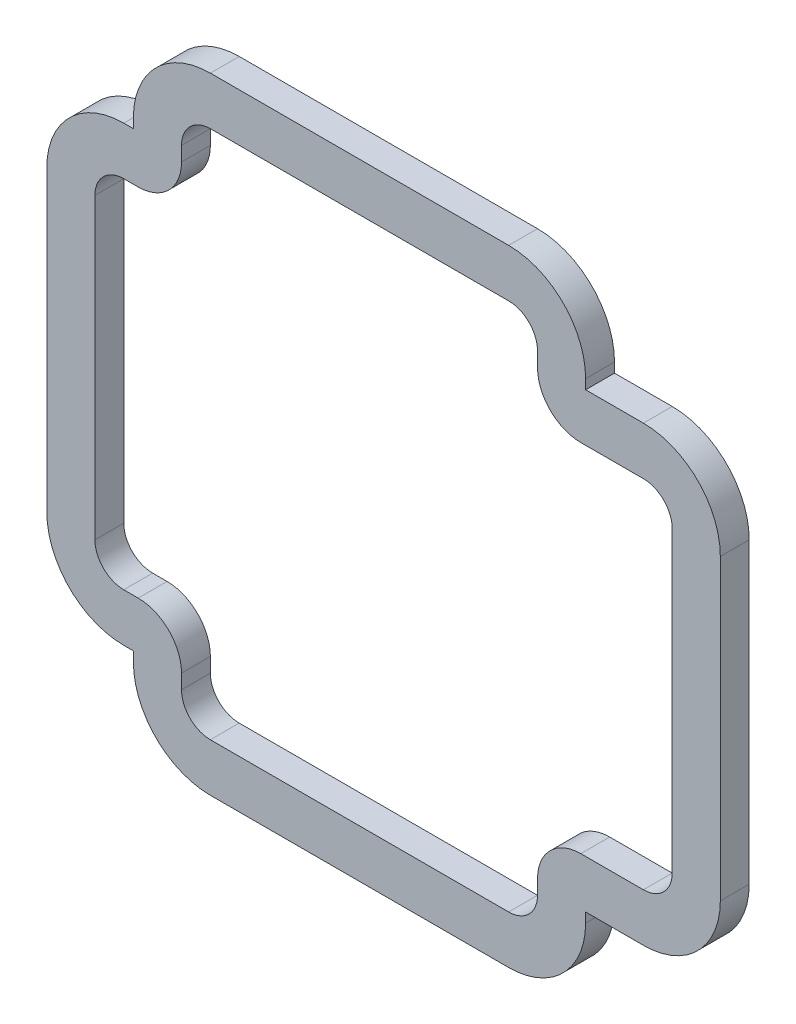
from build123d import *

# Parameters (mm, degrees)
RESSALTO_EXTRUS_O1_DEPTH = 3


with BuildPart() as part:
    # Esboço1 → Ressalto-extrusão1 (new body)
    with BuildSketch(Plane.XY):
        with BuildLine():
            Line((46.5, -1.5), (46.5, -0.5))
            Line((46.5, -0.5), (52.5, -0.5))
            ThreePointArc((52.5, -0.5), (58.156854249, 1.843145751), (60.5, 7.5))
            Line((60.5, 7.5), (60.5, 38.5))
            ThreePointArc((60.5, 38.5), (58.156854249, 44.156854249), (52.5, 46.5))
            Line((52.5, 46.5), (46.5, 46.5))
            Line((46.5, 46.5), (46.5, 47.5))
            ThreePointArc((46.5, 47.5), (44.156854249, 53.156854249), (38.5, 55.5))
            Line((38.5, 55.5), (7.5, 55.5))
            ThreePointArc((7.5, 55.5), (1.843145751, 53.156854249), (-0.5, 47.5))
            Line((-0.5, 47.5), (-0.5, 46.5))
            Line((-0.5, 46.5), (-1.5, 46.5))
            ThreePointArc((-1.5, 46.5), (-7.156854249, 44.156854249), (-9.5, 38.5))
            Line((-9.5, 38.5), (-9.5, 7.5))
            ThreePointArc((-9.5, 7.5), (-7.156854249, 1.843145751), (-1.5, -0.5))
            Line((-1.5, -0.5), (-0.5, -0.5))
            Line((-0.5, -0.5), (-0.5, -1.5))
            ThreePointArc((-0.5, -1.5), (1.843145751, -7.156854249), (7.5, -9.5))
            Line((7.5, -9.5), (38.5, -9.5))
            ThreePointArc((38.5, -9.5), (44.156854249, -7.156854249), (46.5, -1.5))
        make_face()
        with BuildLine():
            Line((41.5, -1.5), (41.5, 0))
            ThreePointArc((41.5, 0), (42.818019485, 3.181980515), (46, 4.5))
            Line((46, 4.5), (52.5, 4.5))
            ThreePointArc((52.5, 4.5), (54.621320344, 5.378679656), (55.5, 7.5))
            Line((55.5, 7.5), (55.5, 38.5))
            ThreePointArc((55.5, 38.5), (54.621320344, 40.621320344), (52.5, 41.5))
            Line((52.5, 41.5), (46, 41.5))
            ThreePointArc((46, 41.5), (42.818019485, 42.818019485), (41.5, 46))
            Line((41.5, 46), (41.5, 47.5))
            ThreePointArc((41.5, 47.5), (40.621320344, 49.621320344), (38.5, 50.5))
            Line((38.5, 50.5), (7.5, 50.5))
            ThreePointArc((7.5, 50.5), (5.378679656, 49.621320344), (4.5, 47.5))
            Line((4.5, 47.5), (4.5, 46))
            ThreePointArc((4.5, 46), (3.181980515, 42.818019485), (0, 41.5))
            Line((0, 41.5), (-1.5, 41.5))
            ThreePointArc((-1.5, 41.5), (-3.621320344, 40.621320344), (-4.5, 38.5))
            Line((-4.5, 38.5), (-4.5, 7.5))
            ThreePointArc((-4.5, 7.5), (-3.621320344, 5.378679656), (-1.5, 4.5))
            Line((-1.5, 4.5), (0, 4.5))
            ThreePointArc((0, 4.5), (3.181980515, 3.181980515), (4.5, 0))
            Line((4.5, 0), (4.5, -1.5))
            ThreePointArc((4.5, -1.5), (5.378679656, -3.621320344), (7.5, -4.5))
            Line((7.5, -4.5), (38.5, -4.5))
            ThreePointArc((38.5, -4.5), (40.621320344, -3.621320344), (41.5, -1.5))
        make_face(mode=Mode.SUBTRACT)
    extrude(amount=RESSALTO_EXTRUS_O1_DEPTH)


solid = part.part
